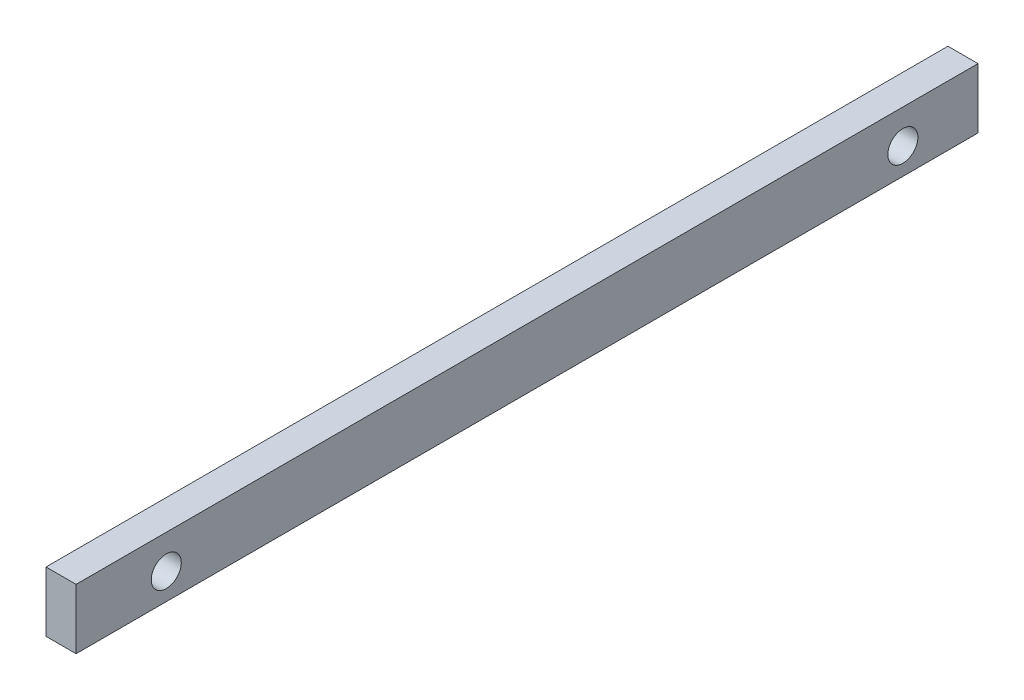
from build123d import *

# Parameters (mm, degrees)
SKETCH1_W           = 120
SKETCH1_H           = 8
SKETCH1_R           = 2
BOSS_EXTRUDE1_DEPTH = 4


with BuildPart() as part:
    # Sketch1 → Boss-Extrude1 (new body)
    with BuildSketch(Plane(origin=(0, 0, 0), x_dir=(0, 0, -1), z_dir=(1, 0, 0))):
        with Locations((19.862658316, 1.315958677)):
            Rectangle(SKETCH1_W, SKETCH1_H)
        with Locations((-28.137341684, 0.827466255)):
            Circle(SKETCH1_R, mode=Mode.SUBTRACT)
        with Locations((69.862658316, 0.827466255)):
            Circle(SKETCH1_R, mode=Mode.SUBTRACT)
    extrude(amount=BOSS_EXTRUDE1_DEPTH)


solid = part.part
